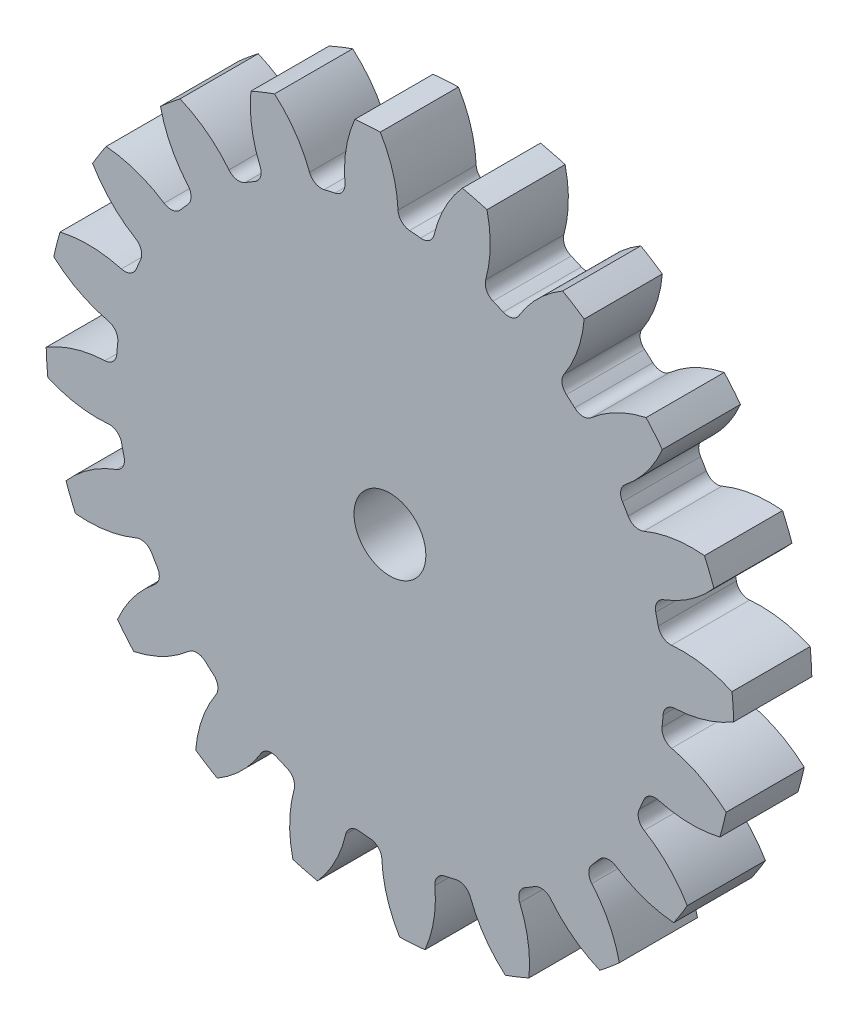
from build123d import *

# Parameters (mm, degrees)
SKETCH3_R         = 13.97
GEARBODY_DEPTH    = 3.175
TOOTHCUT_DEPTH    = 21.010058096
CIRPATTERN1_COUNT = 20
BOREDIA_R         = 1.460500026
BORE_DEPTH        = 12700


with BuildPart() as part:
    # Sketch3 → gearBody (new body)
    with BuildSketch(Plane.XY):
        Circle(SKETCH3_R)
    extrude(amount=GEARBODY_DEPTH)

    # Sketch2 → toothCut (cut, through all)
    with BuildSketch(Plane.XY):
        with BuildLine():
            ThreePointArc((11.055114421, -1.246803989), (11.078104947, -1.022578023), (11.09654807, -0.797932304))
            ThreePointArc((11.09654807, -0.797932304), (11.248380712, -0.471754036), (11.578721183, -0.329203743))
            ThreePointArc((11.578721183, -0.329203743), (13.810169569, 0.302046563), (15.522633304, 1.865794244))
            ThreePointArc((15.522633304, 1.865794244), (15.568180658, -1.437039952), (14.918810012, -4.675728892))
            ThreePointArc((14.918810012, -4.675728892), (13.521529943, -2.824932507), (11.443338244, -1.795875603))
            ThreePointArc((11.443338244, -1.795875603), (11.144673729, -1.595264236), (11.055114421, -1.246803989))
        make_face()
    toothcut = extrude(amount=TOOTHCUT_DEPTH, mode=Mode.SUBTRACT)

    # CirPattern1: toothCut ×20 about axis
    cirpattern1_axis = Axis((0, 0, 3.175), (0, 0, -1))
    for i in range(1, CIRPATTERN1_COUNT):
        add(toothcut.rotate(cirpattern1_axis, i * 360 / CIRPATTERN1_COUNT), mode=Mode.SUBTRACT)

    # boreDia → bore (cut, symmetric)
    with BuildSketch(Plane.XY):
        Circle(BOREDIA_R)
    extrude(amount=BORE_DEPTH, both=True, mode=Mode.SUBTRACT)


solid = part.part
